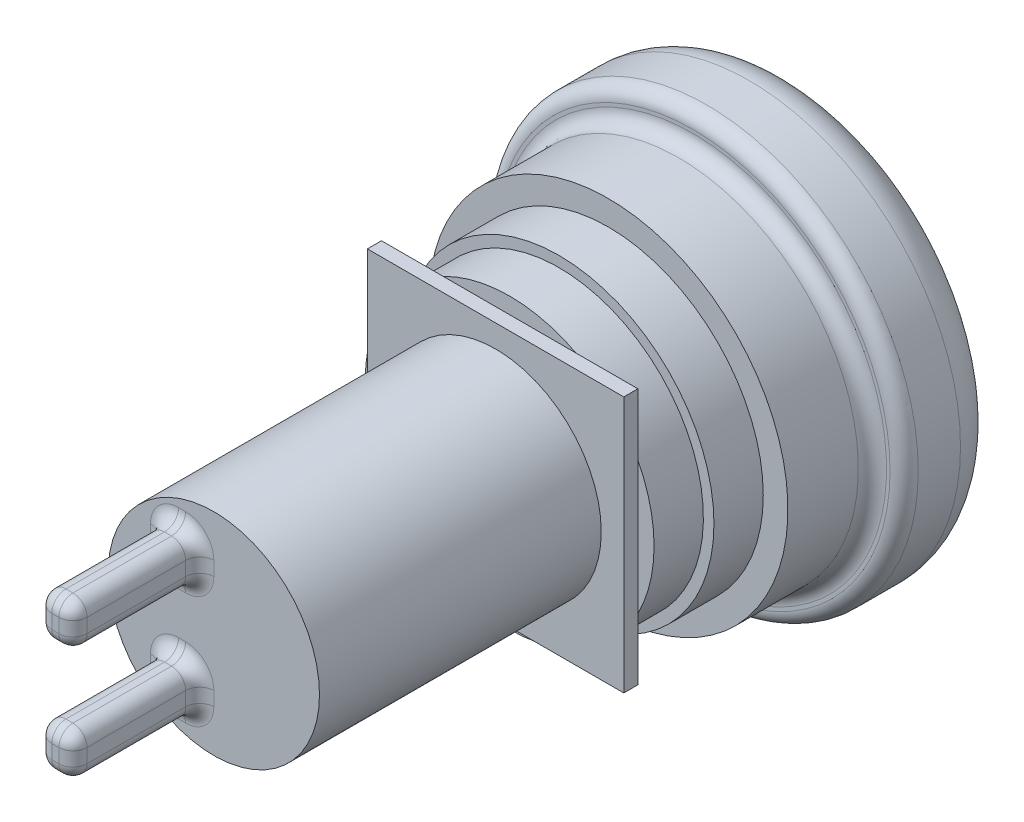
from build123d import *

# Parameters (mm, degrees)
SKETCH1_R           = 7.5
BOSS_EXTRUDE1_DEPTH = 20
SKETCH2_W           = 2.5
SKETCH2_H           = 3
BOSS_EXTRUDE2_DEPTH = 9
SKETCH3_W           = 18.2
SKETCH3_H           = 18.2
BOSS_EXTRUDE3_DEPTH = 1
SKETCH4_R           = 10.25
BOSS_EXTRUDE4_DEPTH = 3.5
SKETCH5_R           = 11
BOSS_EXTRUDE5_DEPTH = 3.5
SKETCH6_R           = 12.75
BOSS_EXTRUDE6_DEPTH = 6
SKETCH7_R           = 15
BOSS_EXTRUDE7_DEPTH = 7
FILLET1_R           = 3
FILLET2_R           = 1
FILLET3_R           = 1


with BuildPart() as part:
    # Sketch1 → Boss-Extrude1 (new body)
    with BuildSketch(Plane.XY):
        Circle(SKETCH1_R)
    extrude(amount=BOSS_EXTRUDE1_DEPTH)

    # Sketch2 → Boss-Extrude2 (add)
    with BuildSketch(Plane.XY.offset(20)):
        with Locations((-2.25, 4)):
            Rectangle(SKETCH2_W, SKETCH2_H)
        with Locations((-2.25, -4)):
            Rectangle(SKETCH2_W, SKETCH2_H)
    extrude(amount=BOSS_EXTRUDE2_DEPTH)

    # Sketch3 → Boss-Extrude3 (add)
    with BuildSketch(Plane(origin=(0, 0, 0), x_dir=(-1, 0, 0), z_dir=(0, 0, -1))):
        Rectangle(SKETCH3_W, SKETCH3_H)
    extrude(amount=BOSS_EXTRUDE3_DEPTH)

    # Sketch4 → Boss-Extrude4 (add)
    with BuildSketch(Plane(origin=(0, 0, -1), x_dir=(-1, 0, 0), z_dir=(0, 0, -1))):
        with Locations(Location((0, 0, 0), (0, 0, 152.598691876))):
            Circle(SKETCH4_R)
    extrude(amount=BOSS_EXTRUDE4_DEPTH)

    # Sketch5 → Boss-Extrude5 (add)
    with BuildSketch(Plane(origin=(0, 0, -4.5), x_dir=(-1, 0, 0), z_dir=(0, 0, -1))):
        Circle(SKETCH5_R)
    extrude(amount=BOSS_EXTRUDE5_DEPTH)

    # Sketch6 → Boss-Extrude6 (add)
    with BuildSketch(Plane(origin=(0, 0, -8), x_dir=(-1, 0, 0), z_dir=(0, 0, -1))):
        Circle(SKETCH6_R)
    extrude(amount=BOSS_EXTRUDE6_DEPTH)

    # Sketch7 → Boss-Extrude7 (add)
    with BuildSketch(Plane(origin=(0, 0, -14), x_dir=(-1, 0, 0), z_dir=(0, 0, -1))):
        Circle(SKETCH7_R)
    extrude(amount=BOSS_EXTRUDE7_DEPTH)

    # Fillet1
    fillet1_edges = [part.edges().sort_by_distance(p)[0] for p in [
        (15, 0, -21),
    ]]
    fillet(fillet1_edges, radius=FILLET1_R)

    # Fillet2
    fillet2_edges = [part.edges().sort_by_distance(p)[0] for p in [
        (12.75, 0, -14),
        (15, 0, -14),
    ]]
    fillet(fillet2_edges, radius=FILLET2_R)

    # Fillet3
    fillet3_edges = [part.edges().sort_by_distance(p)[0] for p in [
        (-1, 4, 29),
        (-2.25, 5.5, 29),
        (-3.5, -4, 20),
        (-3.5, -2.5, 24.5),
        (-2.25, -5.5, 20),
        (-3.5, -5.5, 24.5),
        (-1, -4, 20),
        (-1, -5.5, 24.5),
        (-2.25, -2.5, 20),
        (-1, -2.5, 24.5),
        (-3.5, -4, 29),
        (-2.25, -5.5, 29),
        (-1, -4, 29),
        (-2.25, -2.5, 29),
        (-3.5, 4, 20),
        (-3.5, 5.5, 24.5),
        (-2.25, 2.5, 20),
        (-3.5, 2.5, 24.5),
        (-1, 4, 20),
        (-1, 2.5, 24.5),
        (-2.25, 5.5, 20),
        (-1, 5.5, 24.5),
        (-3.5, 4, 29),
        (-2.25, 2.5, 29),
    ]]
    fillet(fillet3_edges, radius=FILLET3_R)


solid = part.part
